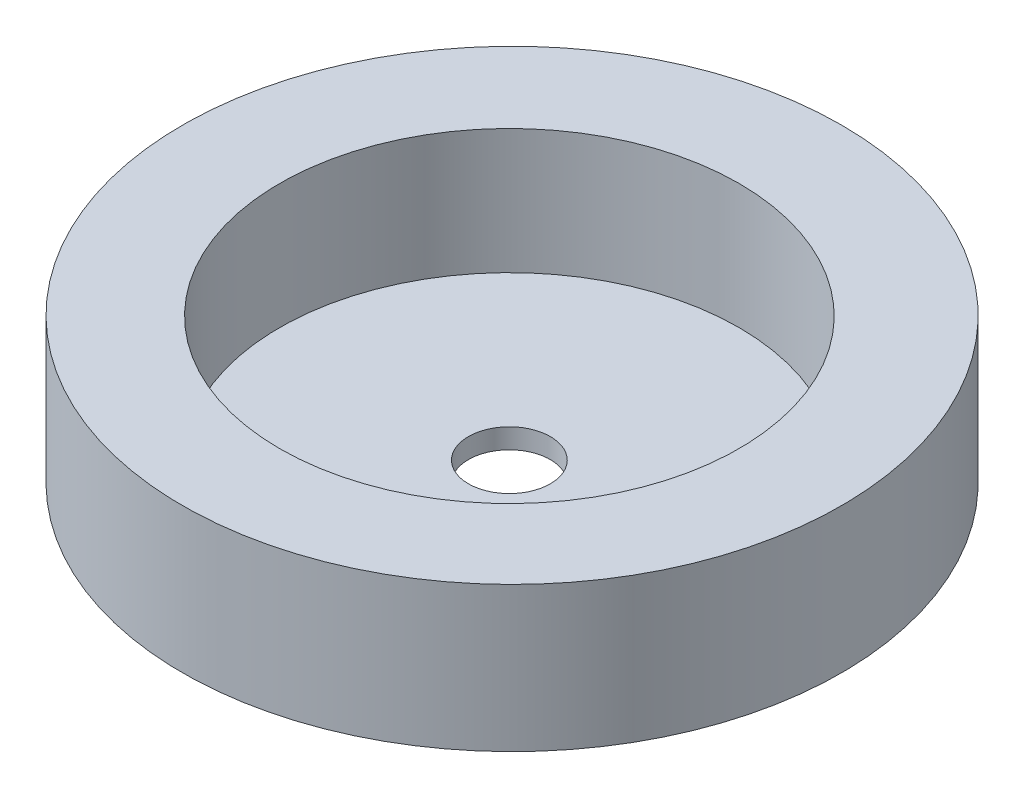
from build123d import *

# Parameters (mm, degrees)
SKETCH1_R           = 16.5
BOSS_EXTRUDE1_DEPTH = 7.25
SKETCH2_R           = 2.05
CUT_EXTRUDE1_DEPTH  = 48.105394919
SKETCH9_R           = 11.5
CUT_EXTRUDE2_DEPTH  = 6.25


with BuildPart() as part:
    # Sketch1 → Boss-Extrude1 (new body)
    with BuildSketch(Plane(origin=(0, 0, 0), x_dir=(1, 0, 0), z_dir=(0, 1, 0))):
        with Locations(Location((-11.073338277, 20.997556543, 0), (0, 0, 90))):
            Circle(SKETCH1_R)
    extrude(amount=BOSS_EXTRUDE1_DEPTH)

    # Sketch2 → Cut-Extrude1 (cut, through all)
    with BuildSketch(Plane(origin=(0, 7.25, 0), x_dir=(1, 0, 0), z_dir=(0, 1, 0))):
        with Locations(Location((-11.112077012, 20.900709706, 0), (0, 0, 270))):
            Circle(SKETCH2_R)
    extrude(amount=-CUT_EXTRUDE1_DEPTH, mode=Mode.SUBTRACT)

    # Sketch9 → Cut-Extrude2 (cut)
    with BuildSketch(Plane(origin=(0, 7.25, 0), x_dir=(1, 0, 0), z_dir=(0, 1, 0))):
        with Locations(Location((-11.112077012, 20.900709706, 0), (0, 0, 270))):
            Circle(SKETCH9_R)
    extrude(amount=-CUT_EXTRUDE2_DEPTH, mode=Mode.SUBTRACT)


solid = part.part
